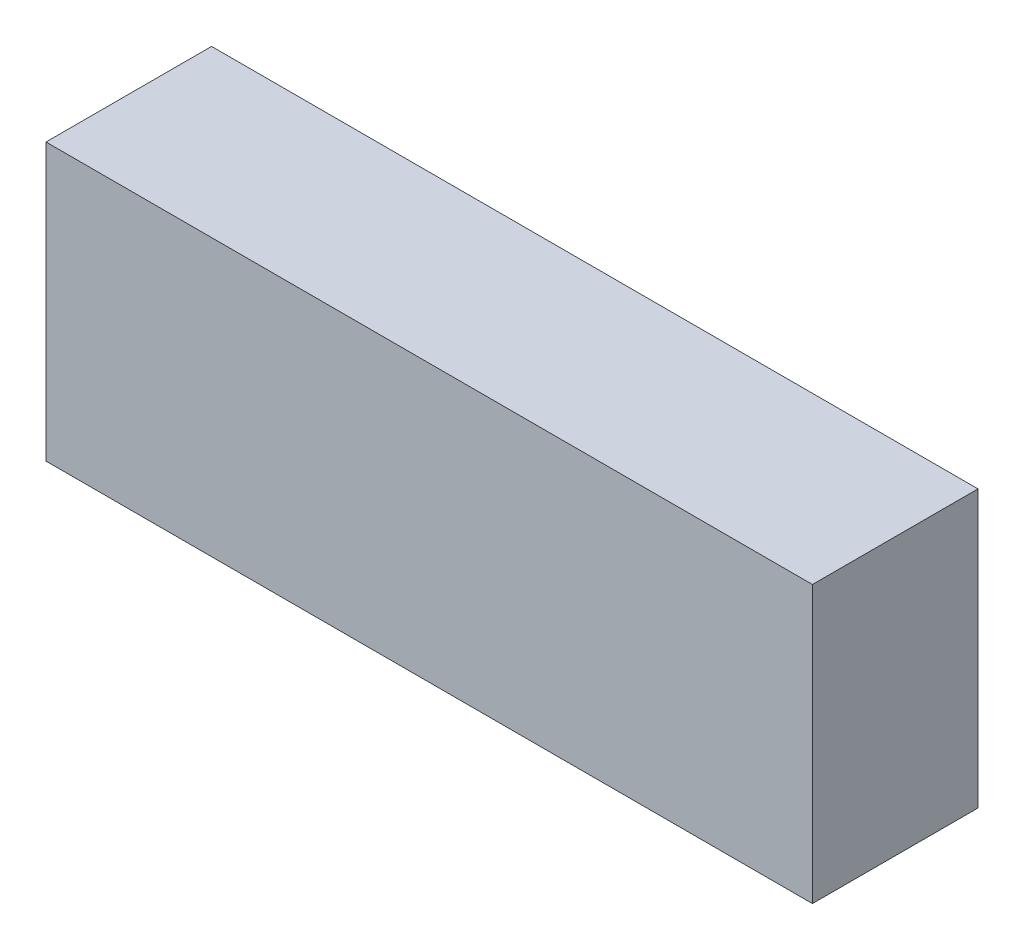
from build123d import *

# Parameters (mm, degrees)
SKETCH1_W                 = 33.56
SKETCH1_H                 = 12.101430126
BOSS_EXTRUDE1_DEPTH       = 7.25
SHELL1_T                  = -0.5
SHELL1_THICKNESS_2_FACE_W = 32.56
SHELL1_THICKNESS_2_FACE_H = 11.101430126
SHELL1_THICKNESS_2_DEPTH  = 0.3


with BuildPart() as part:
    # Sketch1 → Boss-Extrude1 (new body)
    with BuildSketch(Plane.XY):
        with Locations((12.3245, 71.520715063)):
            Rectangle(SKETCH1_W, SKETCH1_H)
    extrude(amount=BOSS_EXTRUDE1_DEPTH)

    # Shell1
    shell1_openings = [part.faces().sort_by_distance(p)[0] for p in [
        (12.3245, 71.520715063, 0),
    ]]
    offset(amount=SHELL1_T, openings=shell1_openings, kind=Kind.INTERSECTION)

    # Shell1 thickness 2 face (on inner face of the shell) → Shell1 thickness 2 (cut)
    with BuildSketch(Plane(origin=(12.3245, 71.520715063, 6.75), x_dir=(1, 0, 0), z_dir=(0, 0, 1))):
        Rectangle(SHELL1_THICKNESS_2_FACE_W, SHELL1_THICKNESS_2_FACE_H)
    extrude(amount=SHELL1_THICKNESS_2_DEPTH, mode=Mode.SUBTRACT)


solid = part.part
